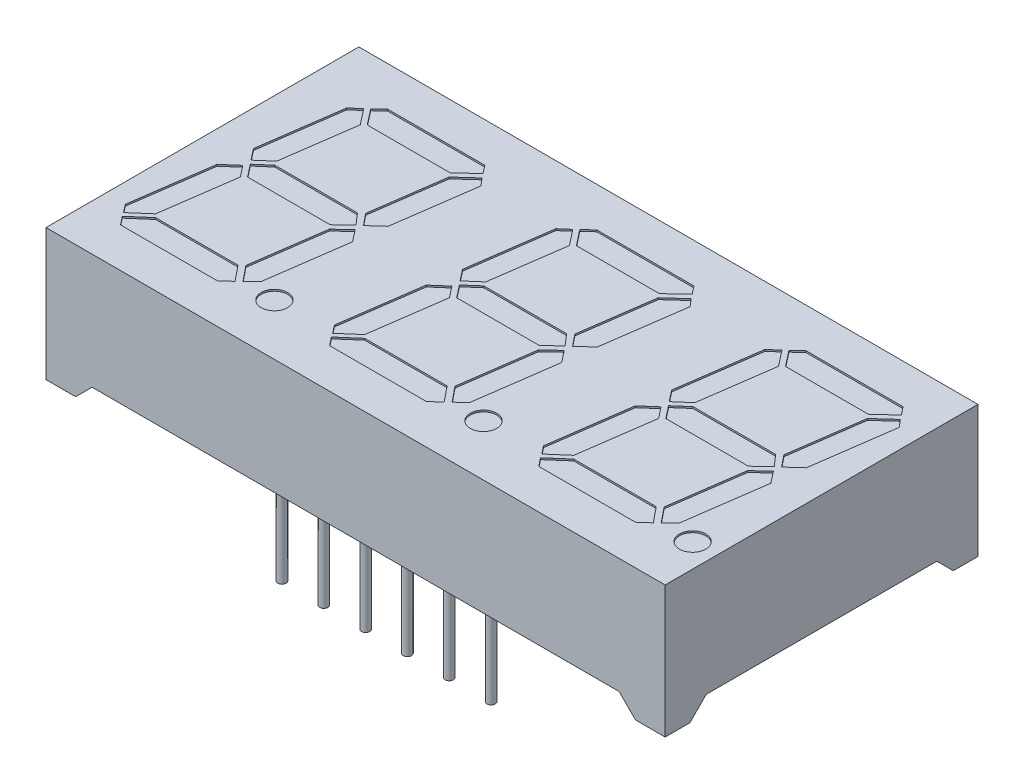
from build123d import *

# Parameters (mm, degrees)
SKETCH1_W           = 37.6
SKETCH1_H           = 19
BOSS_EXTRUDE1_DEPTH = 8
SKETCH2_R           = 0.8
CUT_EXTRUDE2_DEPTH  = 0.1
LPATTERN1_COUNT     = 2
LPATTERN1_PITCH     = 12.7
LPATTERN1_COL_COUNT = 2
LPATTERN1_COL_PITCH = 12.7
SKETCH3_W           = 35.6
SKETCH3_H           = 17
CUT_EXTRUDE3_DEPTH  = 1
CUT_EXTRUDE4_REACH  = 29.901
CUT_EXTRUDE5_REACH  = 41.598
SKETCH6_R           = 0.25
BOSS_EXTRUDE2_DEPTH = 6.3


with BuildPart() as part:
    # Sketch1 → Boss-Extrude1 (new body)
    with BuildSketch(Plane(origin=(0, 0, 0), x_dir=(1, 0, 0), z_dir=(0, 1, 0))):
        Rectangle(SKETCH1_W, SKETCH1_H)
    extrude(amount=-BOSS_EXTRUDE1_DEPTH)

    # Sketch2 → Cut-Extrude2 (cut)
    with BuildSketch(Plane(origin=(0, 0, 0), x_dir=(1, 0, 0), z_dir=(0, 1, 0))):
        with Locations(Location((4.65, -6.38, 0), (0, 0, 270))):
            Circle(SKETCH2_R)
        Polygon((-1.952160074, 7.1), (3.947839926, 7.1), (4.330286309, 6.610490952), (3.300285866, 5.65), (-1.739648247, 5.65), (-2.484598632, 6.603493012), align=None)
        Polygon((-3.974480793, -7.1), (1.896221961, -7.1), (2.47230822, -6.591070163), (1.710455735, -5.65), (-3.295309805, -5.65), (-4.377887189, -6.591070163), align=None)
        Polygon((-2.436227615, 0.725), (2.588908996, 0.725), (3.190979416, 0.03239721), (2.378770347, -0.725), (-2.634272031, -0.725), (-3.228830819, 0.036000546), align=None)
        Polygon((-3.257787721, 5.920086849), (-3.95590304, 0.952738247), (-3.420237283, 0.267117343), (-2.587224094, 0.991244661), (-1.961121981, 5.446192679), (-2.706072366, 6.399685691), align=None)
        Polygon((4.918287738, 5.894984695), (4.223764825, 0.953197385), (3.436295545, 0.241486663), (2.860442223, 0.952803342), (3.485903792, 5.403193652), (4.532747216, 6.349325404), align=None)
        Polygon((-4.227399341, -0.979058314), (-4.914771822, -5.869967647), (-4.533510098, -6.3579604), (-3.492963653, -5.453427176), (-2.858633029, -0.939930263), (-3.394044886, -0.254634337), align=None)
        Polygon((3.9576888, -0.940031907), (3.272664385, -5.814233886), (2.718039978, -6.3579604), (1.96390108, -5.426418363), (2.588908996, -0.979255956), (3.398498757, -0.224301291), align=None)
    cut_extrude2 = extrude(amount=-CUT_EXTRUDE2_DEPTH, mode=Mode.SUBTRACT)

    # LPattern1: Cut-Extrude2 ×2
    with Locations(*[(-i * LPATTERN1_PITCH, 0, 0) for i in range(1, LPATTERN1_COUNT)]):
        add(cut_extrude2, mode=Mode.SUBTRACT)

    # LPattern1 col: Cut-Extrude2 ×2
    with Locations(*[(i * LPATTERN1_COL_PITCH, 0, 0) for i in range(1, LPATTERN1_COL_COUNT)]):
        add(cut_extrude2, mode=Mode.SUBTRACT)

    # Sketch3 → Cut-Extrude3 (cut)
    with BuildSketch(Plane.XZ.offset(8)):
        Rectangle(SKETCH3_W, SKETCH3_H)
    extrude(amount=-CUT_EXTRUDE3_DEPTH, mode=Mode.SUBTRACT)

    # Cut-Extrude4: up to this face of the body (flat: up to its plane)
    cut_extrude4_end = Plane(part.part.faces().sort_by_distance((0, -4, 9.5))[0])
    # Sketch4 → Cut-Extrude4 (cut, up to the picked face)
    with BuildSketch(Plane(origin=(0, 0, -9.5), x_dir=(-1, 0, 0), z_dir=(0, 0, -1)), mode=Mode.PRIVATE) as cut_extrude4_sk1:
        Polygon((-17, -8), (17, -8), (16, -7), (-16, -7), align=None)
    cut_extrude4_tool1 = split(extrude(cut_extrude4_sk1.sketch, amount=-CUT_EXTRUDE4_REACH, mode=Mode.PRIVATE), bisect_by=cut_extrude4_end, keep=Keep.BOTH, mode=Mode.PRIVATE)
    add(cut_extrude4_tool1.solids().sort_by(Axis((0, -7.505051, -9.5), (0, 0, 1)))[0], mode=Mode.SUBTRACT)

    # Cut-Extrude5: up to this face of the body (flat: up to its plane)
    cut_extrude5_end = Plane(part.part.faces().sort_by_distance((-18.8, -4, 0))[0])
    # Sketch5 → Cut-Extrude5 (cut, up to the picked face)
    with BuildSketch(Plane(origin=(18.8, 0, 0), x_dir=(0, 0, -1), z_dir=(1, 0, 0)), mode=Mode.PRIVATE) as cut_extrude5_sk1:
        Polygon((-8, -8), (8, -8), (7, -7), (-7, -7), align=None)
    cut_extrude5_tool1 = split(extrude(cut_extrude5_sk1.sketch, amount=-CUT_EXTRUDE5_REACH, mode=Mode.PRIVATE), bisect_by=cut_extrude5_end, keep=Keep.BOTH, mode=Mode.PRIVATE)
    add(cut_extrude5_tool1.solids().sort_by(Axis((18.8, -7.511111, 0), (-1, 0, 0)))[0], mode=Mode.SUBTRACT)

    # Sketch6 → Boss-Extrude2 (add)
    with BuildSketch(Plane.XZ.offset(7)):
        with Locations(Location((-6.35, -7.62, 0), (0, 0, 270))):
            Circle(SKETCH6_R)
        with Locations(Location((-3.81, -7.62, 0), (0, 0, 270))):
            Circle(SKETCH6_R)
        with Locations(Location((-1.27, -7.62, 0), (0, 0, 270))):
            Circle(SKETCH6_R)
        with Locations(Location((1.27, -7.62, 0), (0, 0, 270))):
            Circle(SKETCH6_R)
        with Locations(Location((3.81, -7.62, 0), (0, 0, 270))):
            Circle(SKETCH6_R)
        with Locations(Location((6.35, -7.62, 0), (0, 0, 270))):
            Circle(SKETCH6_R)
        with Locations(Location((-3.81, 7.62, 0), (0, 0, 270))):
            Circle(SKETCH6_R)
        with Locations(Location((-1.27, 7.62, 0), (0, 0, 270))):
            Circle(SKETCH6_R)
        with Locations(Location((1.27, 7.62, 0), (0, 0, 270))):
            Circle(SKETCH6_R)
        with Locations(Location((3.81, 7.62, 0), (0, 0, 270))):
            Circle(SKETCH6_R)
        with Locations(Location((6.35, 7.62, 0), (0, 0, 270))):
            Circle(SKETCH6_R)
        with Locations(Location((-6.35, 7.62, 0), (0, 0, 270))):
            Circle(SKETCH6_R)
    extrude(amount=BOSS_EXTRUDE2_DEPTH)


solid = part.part
